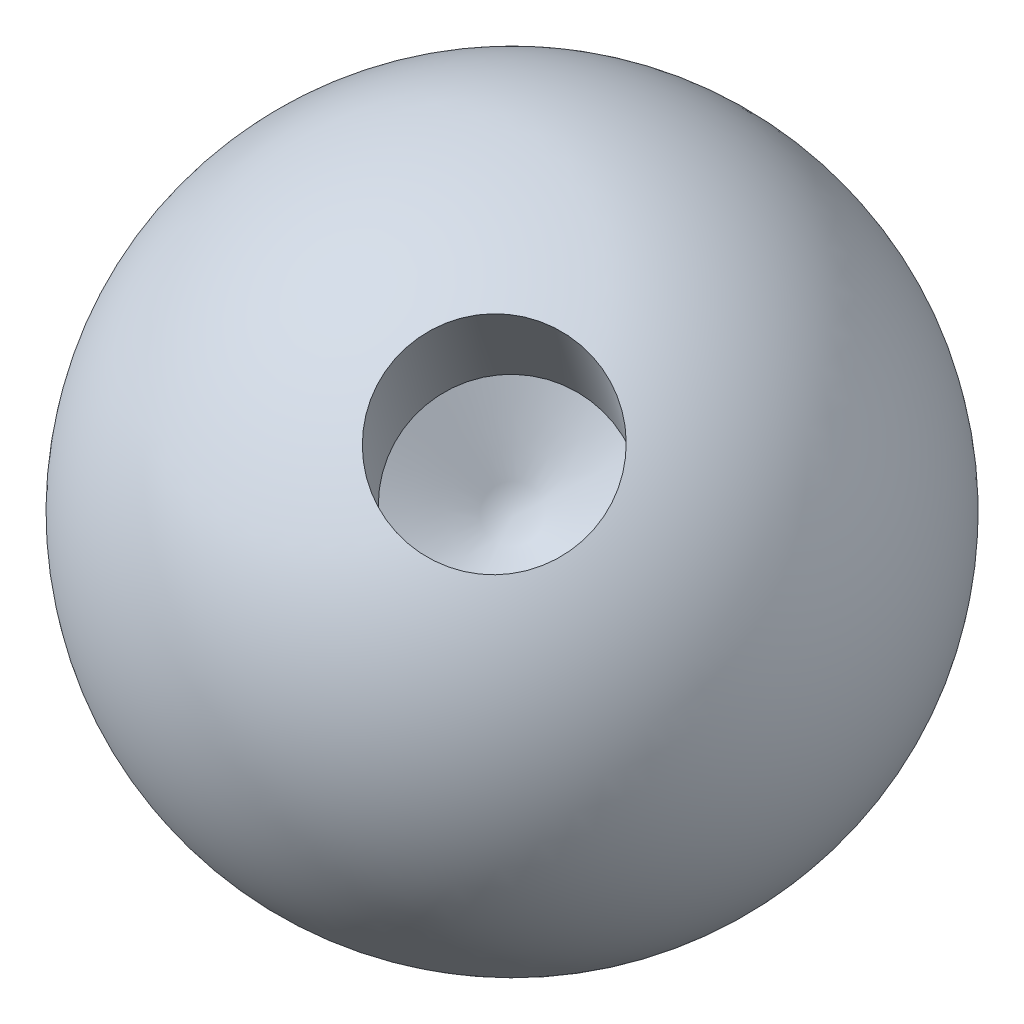
from build123d import *


with BuildPart() as part:
    # Sketch1 → Revolve1 (revolve)
    with BuildSketch(Plane.XY):
        with BuildLine():
            Line((0, 15), (0, -15))
            ThreePointArc((0, -15), (15, 0), (0, 15))
        make_face()
    revolve(axis=Axis((0, 15, 0), (0, -1, 0)))

    # Sketch2 → M10x1.5 Tapped Hole1 (revolve, cut)
    with BuildSketch(Plane(origin=(7.204315507, 10.40685715, 8.049544232), x_dir=(-0.7268207599846388, -0.027665679304091275, 0.6862697669604828), z_dir=(0.490973836014904, -0.7196453186797092, 0.49097383601490413))):
        Polygon((0, 0), (0, 16.053657631), (4.25, 13.5), (4.25, 0), align=None)
    revolve(axis=Axis((10.254142405, 14.812426676, 11.457184624), (-0.48028770045063857, -0.6937904766505685, -0.5366362821360615)), mode=Mode.SUBTRACT)


solid = part.part
